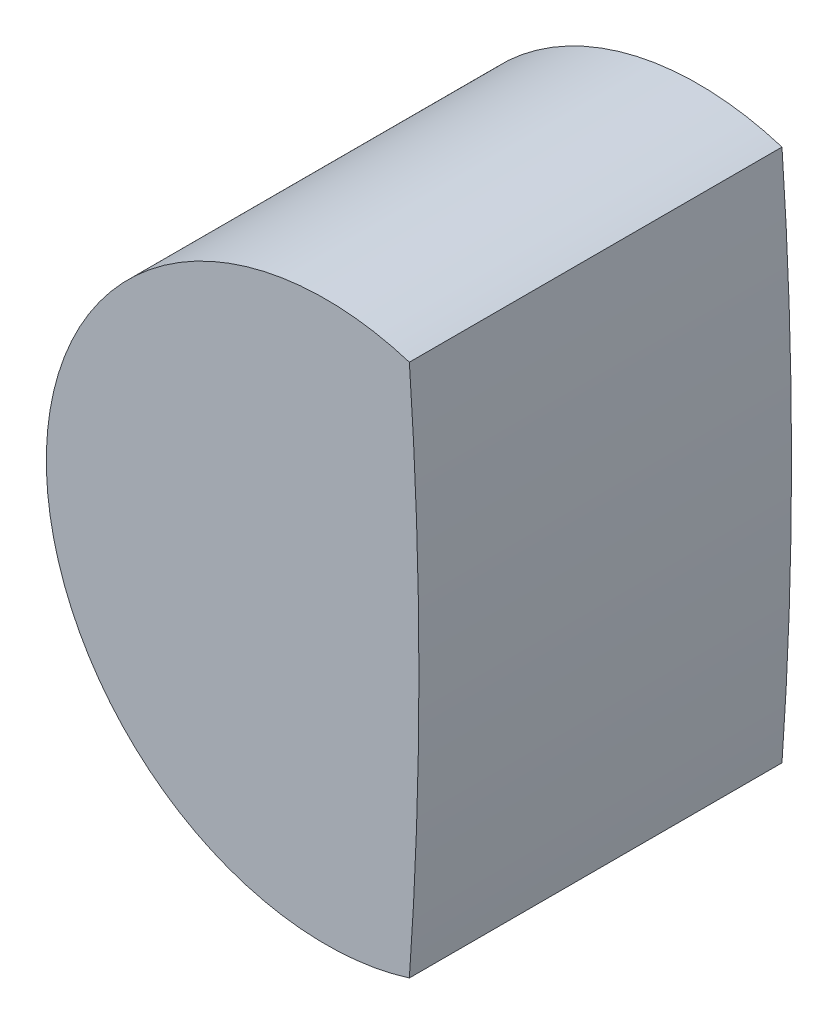
from build123d import *

# Parameters (mm, degrees)
BOSS_EXTRU_1_DEPTH = 2


with BuildPart() as part:
    # Esquisse1 → Boss.-Extru.1 (new body)
    with BuildSketch(Plane.XY):
        with BuildLine():
            ThreePointArc((0.448717949, 1.431311358), (-1.5, 0), (0.448717949, -1.431311358))
            ThreePointArc((0.448717949, -1.431311358), (0.5, 0), (0.448717949, 1.431311358))
        make_face()
    extrude(amount=BOSS_EXTRU_1_DEPTH)


solid = part.part
